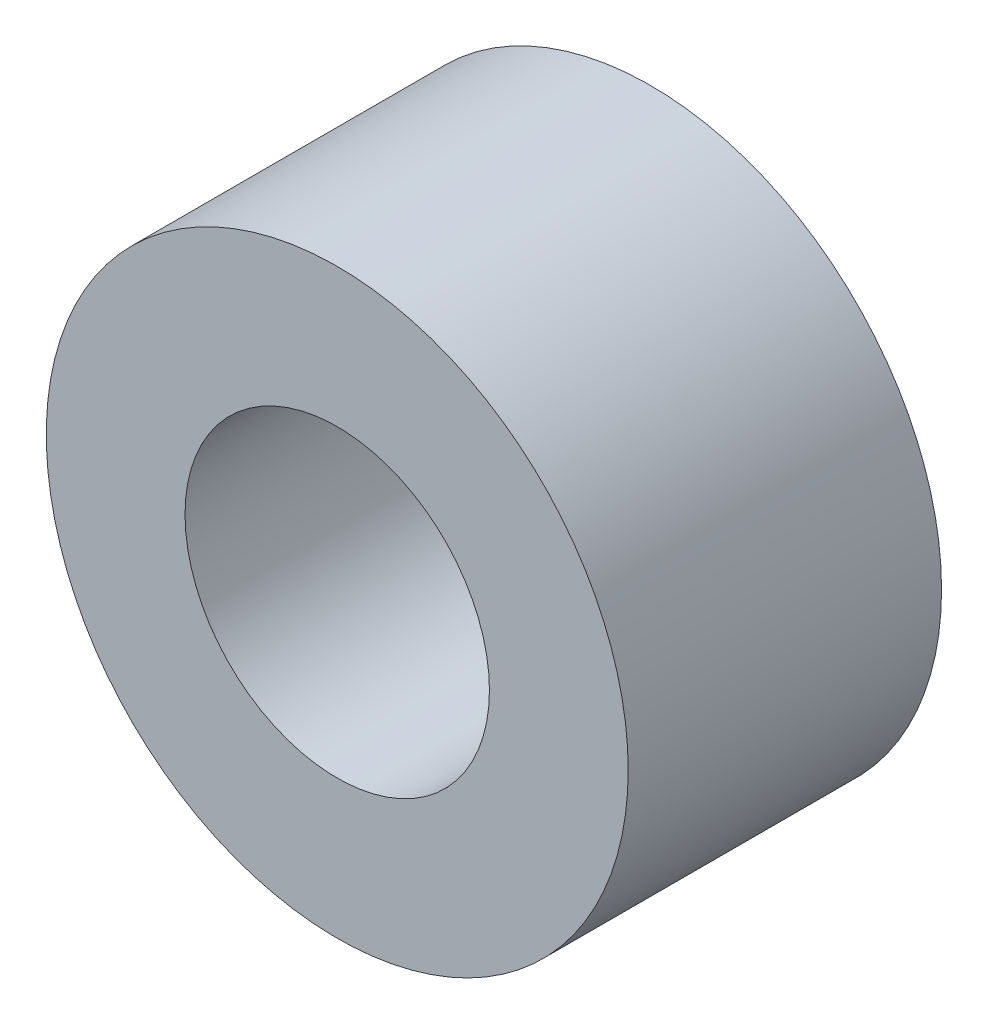
from build123d import *

# Parameters (mm, degrees)
SKETCH_1_R      = 3.25
SKETCH_1_R_2    = 1.7
EXTRUDE_1_DEPTH = 3.5


with BuildPart() as part:
    # 草图1 → 凸台-拉伸1 (new body)
    with BuildSketch(Plane.XY):
        Circle(SKETCH_1_R)
        Circle(SKETCH_1_R_2, mode=Mode.SUBTRACT)
    extrude(amount=EXTRUDE_1_DEPTH)


solid = part.part
